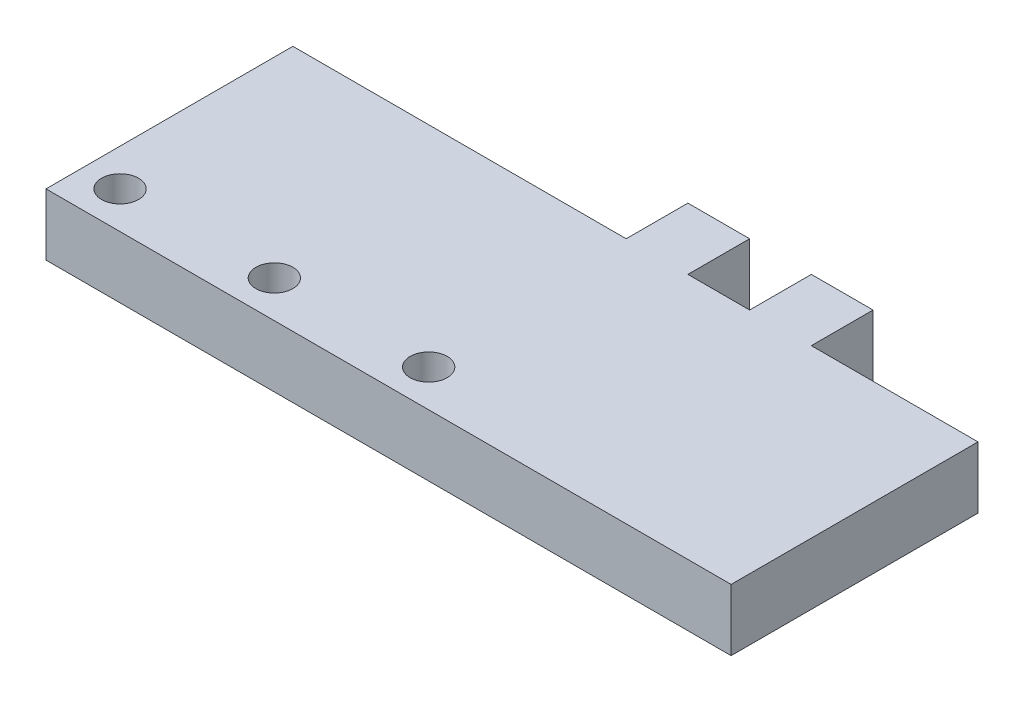
from build123d import *

# Parameters (mm, degrees)
SKETCH1_R                 = 3
BOSS_EXTRUDE1_DEPTH       = 10
M3X0_5_TAPPED_HOLE1_D     = 2.5
M3X0_5_TAPPED_HOLE1_DEPTH = 5
M3X0_5_TAPPED_HOLE1_TIP   = 0.751075774


with BuildPart() as part:
    # Sketch1 → Boss-Extrude1 (new body)
    with BuildSketch(Plane(origin=(0, 0, 0), x_dir=(1, 0, 0), z_dir=(0, 1, 0))):
        Polygon((23.48448278, 27.298019474), (33.48448278, 27.298019474), (33.48448278, 37.298019474), (43.48448278, 37.298019474), (43.48448278, 27.298019474), (70.48448278, 27.298019474), (70.48448278, -12.701980526), (-40.51551722, -12.701980526), (-40.51551722, 27.298019474), (13.48448278, 27.298019474), (13.48448278, 37.298019474), (23.48448278, 37.298019474), align=None)
        with Locations(Location((-34.51551722, -6.701980526, 0), (0, 0, 270))):
            Circle(SKETCH1_R, mode=Mode.SUBTRACT)
        with Locations(Location((-9.51551722, -6.701980526, 0), (0, 0, 270))):
            Circle(SKETCH1_R, mode=Mode.SUBTRACT)
        with Locations(Location((15.48448278, -6.701980526, 0), (0, 0, 270))):
            Circle(SKETCH1_R, mode=Mode.SUBTRACT)
    extrude(amount=BOSS_EXTRUDE1_DEPTH)

    # M3x0.5 Tapped Hole1
    with Locations(Plane(origin=(0, 0, -27.298019474), x_dir=(-1, 0, 0), z_dir=(0, 0, -1))):
        with Locations((-28.48448278, 5)):
            Hole(M3X0_5_TAPPED_HOLE1_D / 2, depth=M3X0_5_TAPPED_HOLE1_DEPTH)
            with Locations((0, 0, -(M3X0_5_TAPPED_HOLE1_DEPTH + M3X0_5_TAPPED_HOLE1_TIP / 2))):  # 118° drill point
                Cone(0, M3X0_5_TAPPED_HOLE1_D / 2, M3X0_5_TAPPED_HOLE1_TIP, mode=Mode.SUBTRACT)


solid = part.part
